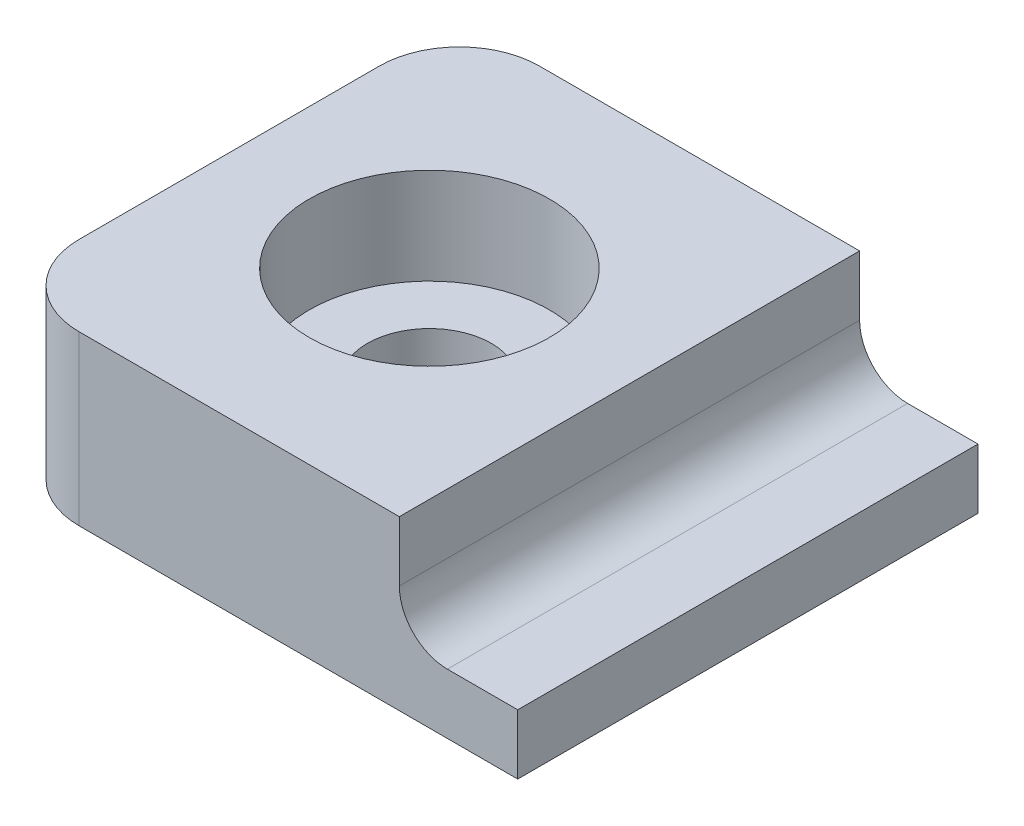
from build123d import *

# Parameters (mm, degrees)
SKETCH1_R                = 13.97
SKETCH1_R_2              = 1.275
BOSS_EXTRUDE1_DEPTH      = 3.048
BOSS_EXTRUDE2_DEPTH      = 7.62
BOSS_EXTRUDE2_DEPTH_BACK = 3.048
SKETCH2_R                = 7.62
SKETCH2_R_2              = 1.275
CUT_EXTRUDE2_DEPTH       = 107.252483849
SKETCH6_R                = 8.89
SKETCH6_R_2              = 3.937
BOSS_EXTRUDE3_DEPTH      = 4.572
FILLET2_R                = 3.048
SKETCH8_W                = 176.271388165
SKETCH8_H                = 26.360341331
CUT_EXTRUDE3_DEPTH       = 107.252483849


with BuildPart() as part:
    # Sketch1 → Boss-Extrude1 (new body)
    with BuildSketch(Plane(origin=(0, 0, 0), x_dir=(1, 0, 0), z_dir=(0, 1, 0))):
        with Locations(Location((0, 0, 0), (0, 0, 90))):
            Circle(SKETCH1_R)
        with Locations(Location((0, 9.5, 0), (0, 0, 90))):
            Circle(SKETCH1_R_2, mode=Mode.SUBTRACT)
        with Locations(Location((9.5, 0, 0), (0, 0, 90))):
            Circle(SKETCH1_R_2, mode=Mode.SUBTRACT)
        with Locations(Location((0, -9.5, 0), (0, 0, 90))):
            Circle(SKETCH1_R_2, mode=Mode.SUBTRACT)
        with Locations(Location((-9.5, 0, 0), (0, 0, 90))):
            Circle(SKETCH1_R_2, mode=Mode.SUBTRACT)
    extrude(amount=BOSS_EXTRUDE1_DEPTH)

    # Sketch2 → Boss-Extrude2 (add, two sides: drawn at the far end of the back side and taken through both)
    with BuildSketch(Plane(origin=(0, 3.048, 0), x_dir=(1, 0, 0), z_dir=(0, 1, 0)).offset(-BOSS_EXTRUDE2_DEPTH_BACK)):
        with BuildLine():
            Line((-96.52, -14.605), (96.52, -14.605))
            ThreePointArc((96.52, -14.605), (100.112102448, -13.117102448), (101.6, -9.525))
            Line((101.6, -9.525), (101.6, 9.525))
            ThreePointArc((101.6, 9.525), (100.112102448, 13.117102448), (96.52, 14.605))
            Line((96.52, 14.605), (-96.52, 14.605))
            ThreePointArc((-96.52, 14.605), (-100.112102448, 13.117102448), (-101.6, 9.525))
            Line((-101.6, 9.525), (-101.6, -9.525))
            ThreePointArc((-101.6, -9.525), (-100.112102448, -13.117102448), (-96.52, -14.605))
        make_face()
        with Locations(Location((-88.9, 0, 0), (0, 0, 270))):
            Circle(SKETCH2_R, mode=Mode.SUBTRACT)
        with Locations(Location((88.9, 0, 0), (0, 0, 270))):
            Circle(SKETCH2_R, mode=Mode.SUBTRACT)
        with Locations(Location((9.5, 0, 0), (0, 0, 90))):
            Circle(SKETCH2_R_2, mode=Mode.SUBTRACT)
        with Locations(Location((0, 9.5, 0), (0, 0, 90))):
            Circle(SKETCH2_R_2, mode=Mode.SUBTRACT)
        with Locations(Location((-9.5, 0, 0), (0, 0, 90))):
            Circle(SKETCH2_R_2, mode=Mode.SUBTRACT)
        with Locations(Location((0, -9.5, 0), (0, 0, 90))):
            Circle(SKETCH2_R_2, mode=Mode.SUBTRACT)
    extrude(amount=BOSS_EXTRUDE2_DEPTH + BOSS_EXTRUDE2_DEPTH_BACK)

    # Sketch5 → Cut-Extrude2 (cut, through all)
    with BuildSketch(Plane(origin=(0, 0, -14.605), x_dir=(-1, 0, 0), z_dir=(0, 0, -1))):
        Polygon((-76.2, 3.81), (0, 3.81), (76.2, 3.81), (76.2, 10.668), (-76.2, 10.668), align=None)
    extrude(amount=-CUT_EXTRUDE2_DEPTH, mode=Mode.SUBTRACT)

    # Sketch6 → Boss-Extrude3 (add)
    # profile 1 of 2: a face of its own
    with BuildSketch(Plane.XZ):
        with Locations((-88.9, 0)):
            Circle(SKETCH6_R)
        with Locations(Location((-88.9, 0, 0), (0, 0, 270))):
            Circle(SKETCH6_R_2, mode=Mode.SUBTRACT)
    # profile 2 of 2: a face of its own
    with BuildSketch(Plane.XZ):
        with Locations((88.9, 0)):
            Circle(SKETCH6_R)
        with Locations(Location((88.9, 0, 0), (0, 0, 270))):
            Circle(SKETCH6_R_2, mode=Mode.SUBTRACT)
    extrude(amount=-BOSS_EXTRUDE3_DEPTH)

    # Fillet2
    fillet2_edges = [part.edges().sort_by_distance(p)[0] for p in [
        (-76.2, 3.81, 0),
        (76.2, 3.81, 0),
    ]]
    fillet(fillet2_edges, radius=FILLET2_R)

    # Sketch8 → Cut-Extrude3 (cut, through all)
    with BuildSketch(Plane.XY.offset(14.605)):
        with Locations((19.448788421, -1.041773615)):
            Rectangle(SKETCH8_W, SKETCH8_H)
    extrude(amount=-CUT_EXTRUDE3_DEPTH, mode=Mode.SUBTRACT)


solid = part.part
